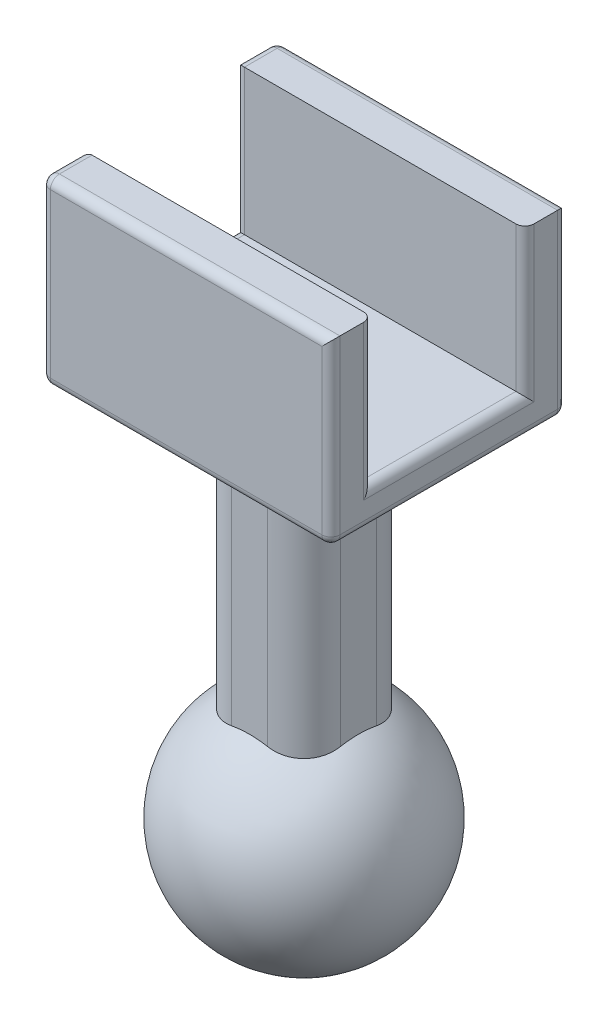
from build123d import *

# Parameters (mm, degrees)
SKETCH2_W           = 15.24
SKETCH2_H           = 15.24
BOSS_EXTRUDE1_DEPTH = 50.8
FILLET1_R           = 5.08
SKETCH4_W           = 40.555388052
SKETCH4_H           = 33.02
BOSS_EXTRUDE3_DEPTH = 25.4
SKETCH5_W           = 40.555388052
SKETCH5_H           = 21.336
CUT_EXTRUDE1_DEPTH  = 20.32
FILLET2_R           = 1.27
SKETCH3_R           = 11.43
BOSS_EXTRUDE2_DEPTH = 2.54


with BuildPart() as part:
    # Sketch1 → Revolve1 (revolve)
    with BuildSketch(Plane.XY):
        with BuildLine():
            Line((0, -15.875), (0, 15.875))
            ThreePointArc((0, 15.875), (15.875, 0), (0, -15.875))
        make_face()
    revolve(axis=Axis((0, -15.875, 0), (0, 1, 0)))

    # Sketch2 → Boss-Extrude1 (add)
    with BuildSketch(Plane(origin=(0, 0, 0), x_dir=(1, 0, 0), z_dir=(0, 1, 0))):
        Rectangle(SKETCH2_W, SKETCH2_H)
    extrude(amount=BOSS_EXTRUDE1_DEPTH)

    # Fillet1
    fillet1_edges = [part.edges().sort_by_distance(p)[0] for p in [
        (-7.62, 31.228525221, -7.62),
        (-7.62, 31.228525221, 7.62),
        (7.62, 31.228525221, 7.62),
        (7.62, 31.228525221, -7.62),
    ]]
    fillet(fillet1_edges, radius=FILLET1_R)

    # Sketch4 → Boss-Extrude3 (add)
    with BuildSketch(Plane(origin=(0, 50.8, 0), x_dir=(1, 0, 0), z_dir=(0, 1, 0))):
        Rectangle(SKETCH4_W, SKETCH4_H)
    extrude(amount=BOSS_EXTRUDE3_DEPTH)

    # Sketch5 → Cut-Extrude1 (cut)
    with BuildSketch(Plane(origin=(0, 76.2, 0), x_dir=(1, 0, 0), z_dir=(0, 1, 0))):
        Rectangle(SKETCH5_W, SKETCH5_H)
    extrude(amount=-CUT_EXTRUDE1_DEPTH, mode=Mode.SUBTRACT)

    # Fillet2
    fillet2_edges = [part.edges().sort_by_distance(p)[0] for p in [
        (-20.277694026, 50.8, 0),
        (-20.277694026, 63.5, -16.51),
        (0, 50.8, 16.51),
        (-20.277694026, 63.5, 16.51),
        (20.277694026, 50.8, 0),
        (20.277694026, 63.5, 16.51),
        (0, 50.8, -16.51),
        (20.277694026, 63.5, -16.51),
        (-20.277694026, 76.2, -13.589),
        (0, 76.2, 16.51),
        (0, 76.2, -16.51),
        (-20.277694026, 76.2, 13.589),
        (-20.277694026, 55.88, 0),
        (-20.277694026, 66.04, 10.668),
        (-20.277694026, 66.04, -10.668),
        (20.277694026, 55.88, 0),
        (20.277694026, 66.04, -10.668),
        (20.277694026, 66.04, 10.668),
    ]]
    fillet(fillet2_edges, radius=FILLET2_R)

    # Sketch3 → Boss-Extrude2 (add)
    with BuildSketch(Plane(origin=(0, 50.8, 0), x_dir=(1, 0, 0), z_dir=(0, 1, 0))):
        Circle(SKETCH3_R)
    extrude(amount=BOSS_EXTRUDE2_DEPTH)


solid = part.part
